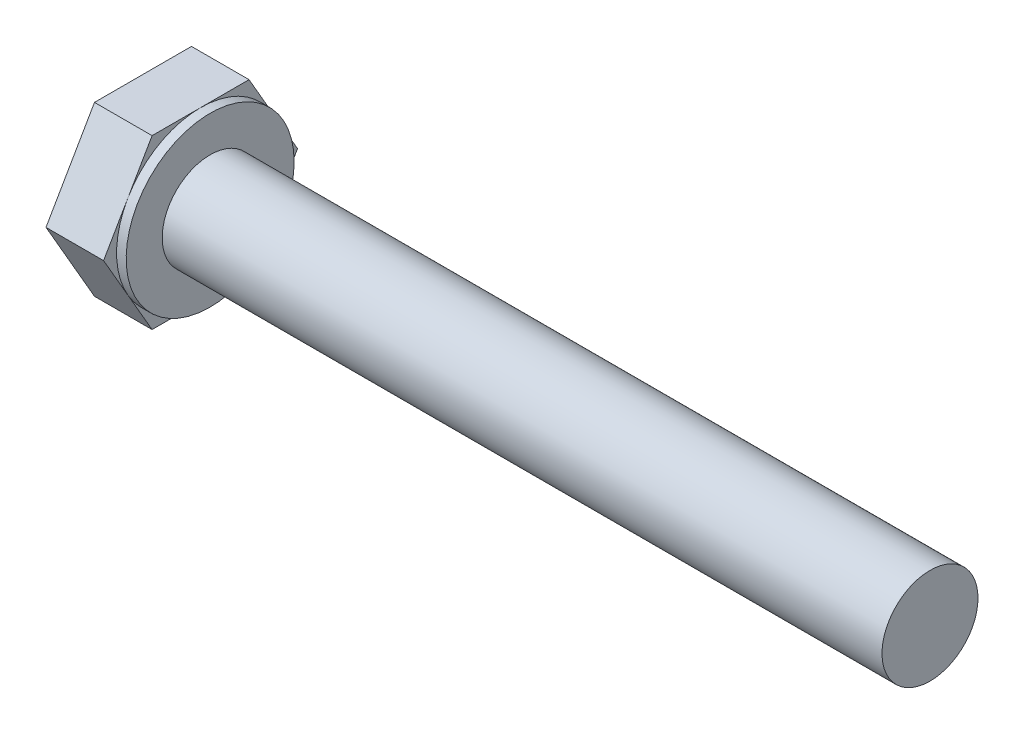
from build123d import *

# Parameters (mm, degrees)
BOSS_EXTRUDE1_DEPTH = 2.4
SKETCH2_R           = 3.5
BOSS_EXTRUDE2_DEPTH = 0.4
SKETCH3_R           = 2
BOSS_EXTRUDE3_DEPTH = 30


with BuildPart() as part:
    # Sketch1 → Boss-Extrude1 (new body)
    with BuildSketch(Plane(origin=(0, 0, 0), x_dir=(0, 0, -1), z_dir=(1, 0, 0))):
        Polygon((-4.041451884, 0), (-2.020725942, -3.5), (2.020725942, -3.5), (4.041451884, 0), (2.020725942, 3.5), (-2.020725942, 3.5), align=None)
    extrude(amount=-BOSS_EXTRUDE1_DEPTH)

    # Sketch2 → Boss-Extrude2 (add)
    with BuildSketch(Plane(origin=(0, 0, 0), x_dir=(0, 0, -1), z_dir=(1, 0, 0))):
        with Locations(Location((0, 0, 0), (0, 0, 150))):
            Circle(SKETCH2_R)
    extrude(amount=BOSS_EXTRUDE2_DEPTH)

    # Sketch3 → Boss-Extrude3 (add)
    with BuildSketch(Plane(origin=(0.4, 0, 0), x_dir=(0, 0, -1), z_dir=(1, 0, 0))):
        Circle(SKETCH3_R)
    extrude(amount=BOSS_EXTRUDE3_DEPTH)


solid = part.part
